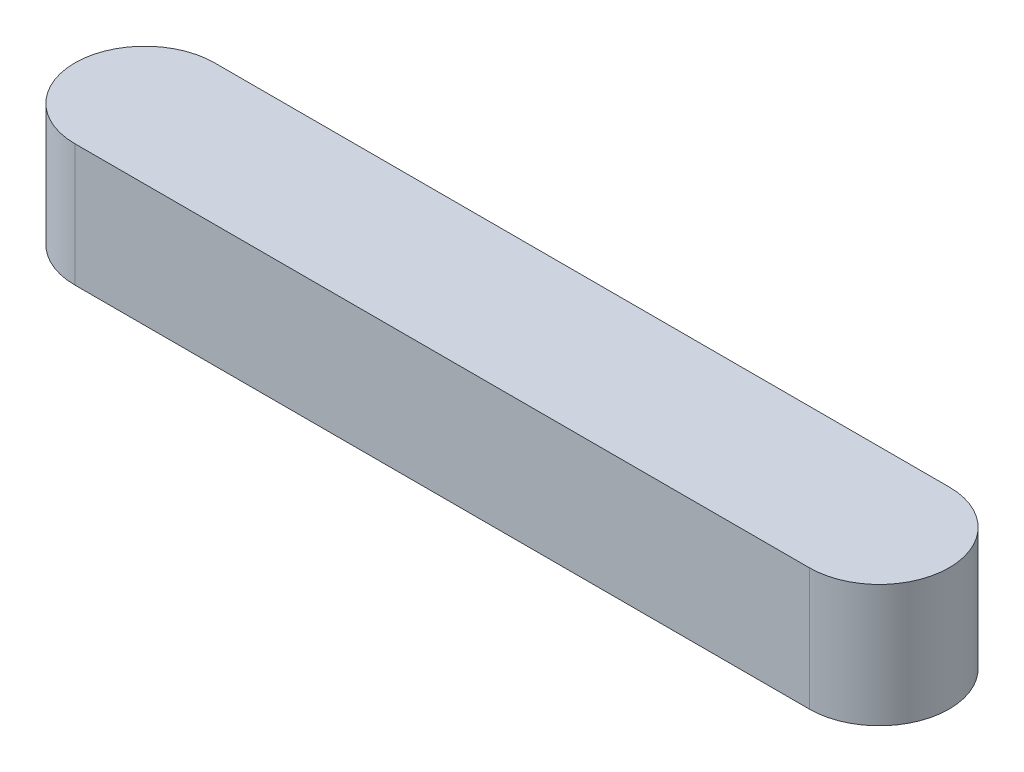
from build123d import *

# Parameters (mm, degrees)
EXTRUDE_1_DEPTH = 7


with BuildPart() as part:
    # Эскиз1 → Бобышка-Вытянуть1 (new body)
    with BuildSketch(Plane(origin=(0, 0, 0), x_dir=(1, 0, 0), z_dir=(0, 1, 0))):
        with BuildLine():
            Line((0, 4), (42, 4))
            ThreePointArc((42, 4), (46, 0), (42, -4))
            Line((42, -4), (0, -4))
            ThreePointArc((0, -4), (-4, 0), (0, 4))
        make_face()
    extrude(amount=EXTRUDE_1_DEPTH)


solid = part.part
